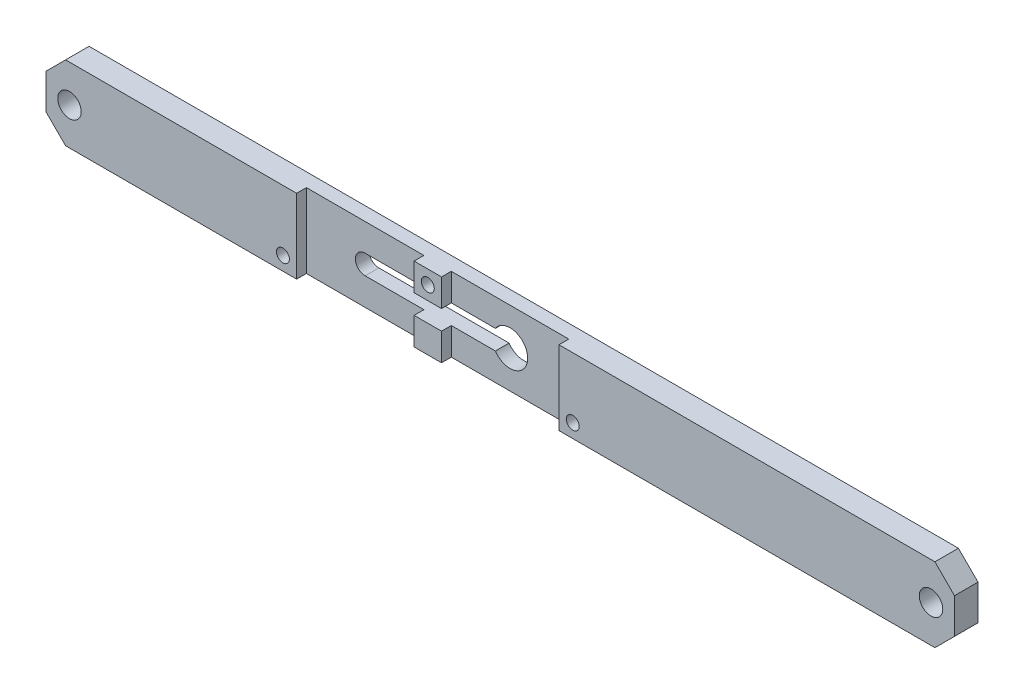
from build123d import *

# Parameters (mm, degrees)
SKETCH_1_W                   = 232
SKETCH_1_H                   = 19
EXTRUDE_1_DEPTH              = 6
SKETCH_3_W                   = 30
SKETCH_3_H                   = 19
CUT_EXTRUDE_2_DEPTH          = 2.5
SKETCH_5_R                   = 3
CUT_EXTRUDE_4_DEPTH          = 117.542910552
SKETCH_4_R                   = 4.5
CUT_EXTRUDE_3_DEPTH          = 117.542910552
CHAMFER_1_SIZE               = 5
HOLE_WIZARD_M6_1_D           = 3.3
HOLE_WIZARD_M6_1_CSINK_D     = 6
HOLE_WIZARD_M6_1_CSINK_ANGLE = 90


with BuildPart() as part:
    # 草图1 → 凸台-拉伸1 (new body)
    with BuildSketch(Plane.XY):
        Rectangle(SKETCH_1_W, SKETCH_1_H)
    extrude(amount=EXTRUDE_1_DEPTH)

    # 草图3 → 切除-拉伸2 (cut)
    with BuildSketch(Plane.XY.offset(6)):
        with Locations((-37, 0)):
            Rectangle(SKETCH_3_W, SKETCH_3_H)
        Rectangle(SKETCH_3_W, SKETCH_3_H)
    extrude(amount=-CUT_EXTRUDE_2_DEPTH, mode=Mode.SUBTRACT)

    # 草图5 → 切除-拉伸4 (cut, through all)
    with BuildSketch(Plane.XY.offset(6)):
        with Locations((110, 0)):
            Circle(SKETCH_5_R)
        with Locations((-110, 0)):
            Circle(SKETCH_5_R)
    extrude(amount=-CUT_EXTRUDE_4_DEPTH, mode=Mode.SUBTRACT)

    # 草图4 → 切除-拉伸3 (cut, through all)
    with BuildSketch(Plane.XY.offset(6)):
        Circle(SKETCH_4_R)
        with BuildLine():
            Line((-37, 2.5), (0, 2.5))
            ThreePointArc((0, 2.5), (2.5, 0), (0, -2.5))
            Line((0, -2.5), (-37, -2.5))
            ThreePointArc((-37, -2.5), (-39.5, 0), (-37, 2.5))
        make_face()
    extrude(amount=-CUT_EXTRUDE_3_DEPTH, mode=Mode.SUBTRACT)

    # 倒角1
    chamfer_1_edges = [part.edges().sort_by_distance(p)[0] for p in [
        (-116, 9.5, 3),
        (116, 9.5, 3),
        (116, -9.5, 3),
        (-116, -9.5, 3),
    ]]
    chamfer(chamfer_1_edges, length=CHAMFER_1_SIZE)

    # M6 内六角花形半沉头螺钉的锥形沉头孔1 (through all)
    with Locations(Plane(origin=(0, 0, 0), x_dir=(1, 0, 0), z_dir=(0, 0, -1))):
        with Locations((-18.5, -6), (-55.5, 6), (18.5, 6)):
            CounterSinkHole(HOLE_WIZARD_M6_1_D / 2, HOLE_WIZARD_M6_1_CSINK_D / 2, counter_sink_angle=HOLE_WIZARD_M6_1_CSINK_ANGLE)


solid = part.part
